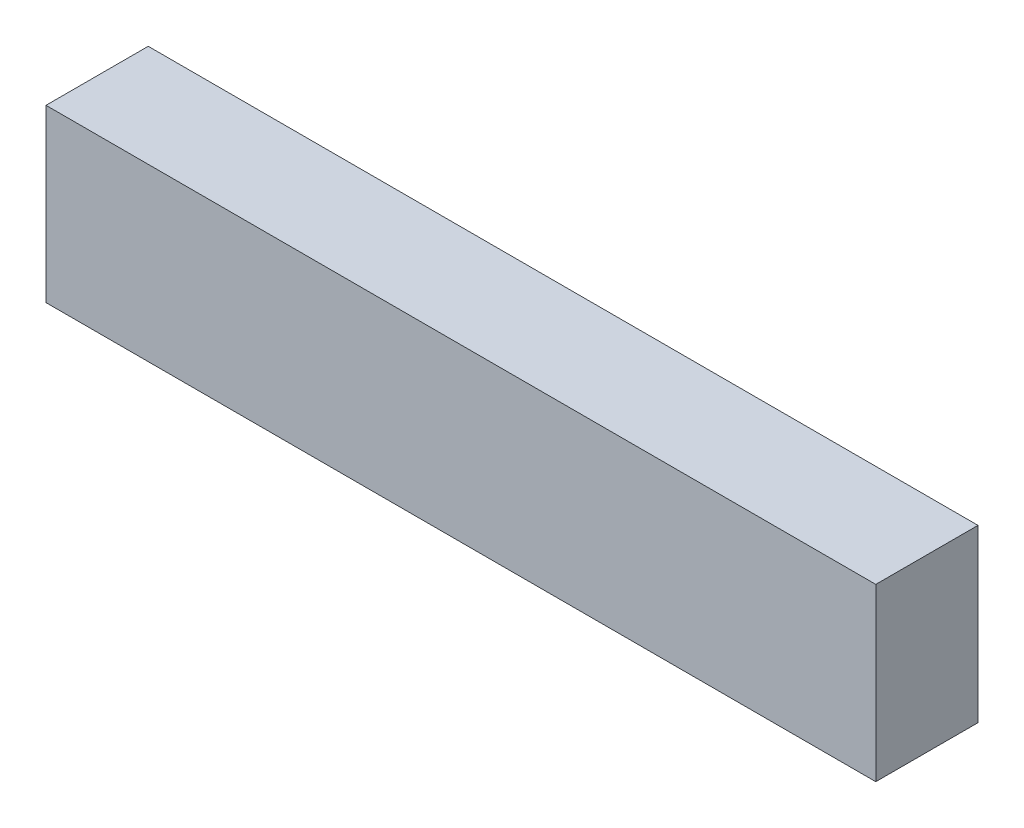
from build123d import *

# Parameters (mm, degrees)
SKETCH1_W                 = 58.85230149
SKETCH1_H                 = 12.121430126
BOSS_EXTRUDE1_DEPTH       = 7.25
SHELL1_T                  = -0.5
SHELL1_THICKNESS_2_FACE_W = 57.85230149
SHELL1_THICKNESS_2_FACE_H = 11.121430126
SHELL1_THICKNESS_2_DEPTH  = 0.3


with BuildPart() as part:
    # Sketch1 → Boss-Extrude1 (new body)
    with BuildSketch(Plane.XY):
        with Locations((49.610650745, -71.510715063)):
            Rectangle(SKETCH1_W, SKETCH1_H)
    extrude(amount=BOSS_EXTRUDE1_DEPTH)

    # Shell1
    shell1_openings = [part.faces().sort_by_distance(p)[0] for p in [
        (49.610650745, -71.510715063, 0),
    ]]
    offset(amount=SHELL1_T, openings=shell1_openings, kind=Kind.INTERSECTION)

    # Shell1 thickness 2 face (on inner face of the shell) → Shell1 thickness 2 (cut)
    with BuildSketch(Plane(origin=(49.610650745, -71.510715063, 6.75), x_dir=(1, 0, 0), z_dir=(0, 0, 1))):
        Rectangle(SHELL1_THICKNESS_2_FACE_W, SHELL1_THICKNESS_2_FACE_H)
    extrude(amount=SHELL1_THICKNESS_2_DEPTH, mode=Mode.SUBTRACT)


solid = part.part
